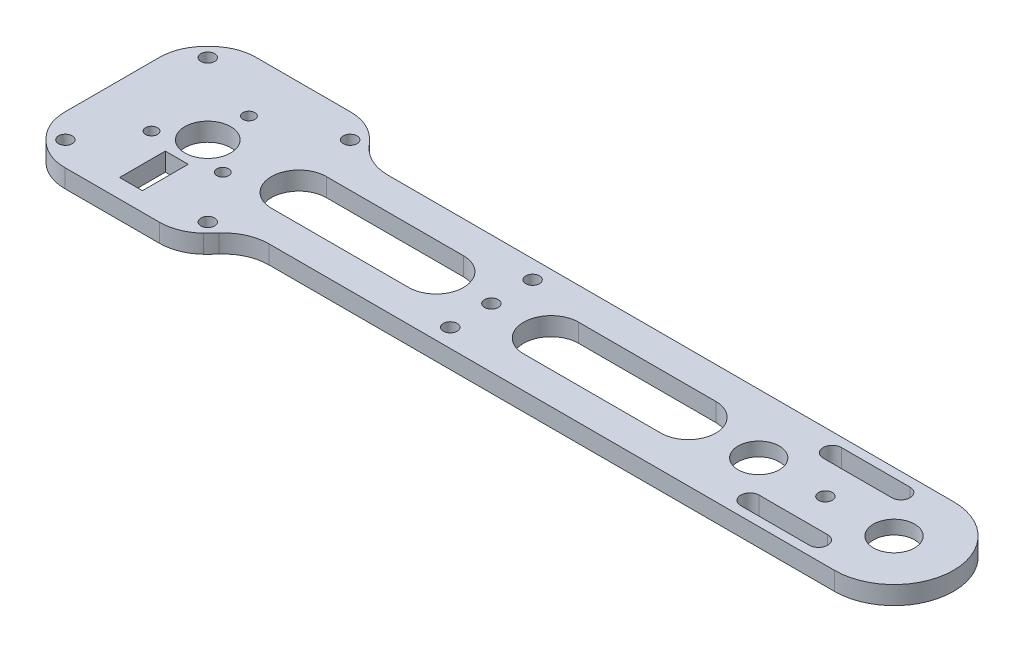
from build123d import *

# Parameters (mm, degrees)
SKETCH_1_R          = 5
SKETCH_1_R_2        = 4.505
SKETCH_1_R_3        = 1.3
SKETCH_1_R_4        = 1.5
SKETCH_1_W          = 5
SKETCH_1_H          = 10
EXTRUDE_1_DEPTH     = 4
SKETCH_2_R          = 6.01
CUT_EXTRUDE_1_DEPTH = 1
CUT_EXTRUDE_4_DEPTH = 4
FILLET_1_R          = 10


with BuildPart() as part:
    # 草图1 → 凸台-拉伸1 (new body)
    with BuildSketch(Plane(origin=(0, 0, 0), x_dir=(1, 0, 0), z_dir=(0, 1, 0))):
        with BuildLine():
            Line((150, 13), (21.354156504, 13))
            ThreePointArc((21.354156504, 13), (17.988228463, 17.361556288), (13.748715927, 20.879961934))
            Line((13.748715927, 20.879961934), (-13.748715927, 20.879961934))
            ThreePointArc((-13.748715927, 20.879961934), (-17.67766953, 17.67766953), (-20.879961934, 13.748715927))
            Line((-20.879961934, 13.748715927), (-20.879961934, -13.748715927))
            ThreePointArc((-20.879961934, -13.748715927), (-17.67766953, -17.67766953), (-13.748715927, -20.879961934))
            Line((-13.748715927, -20.879961934), (13.748715927, -20.879961934))
            ThreePointArc((13.748715927, -20.879961934), (17.988228463, -17.361556288), (21.354156504, -13))
            Line((21.354156504, -13), (150, -13))
            ThreePointArc((150, -13), (163, 0), (150, 13))
        make_face()
        with Locations(Location((0, 0, 0), (0, 0, 270))):
            Circle(SKETCH_1_R, mode=Mode.SUBTRACT)
        with Locations(Location((150, 0, 0), (0, 0, 270))):
            Circle(SKETCH_1_R_2, mode=Mode.SUBTRACT)
        with Locations(Location((120.4195, 0, 0), (0, 0, 270))):
            Circle(SKETCH_1_R_2, mode=Mode.SUBTRACT)
        with Locations(Location((0, 9, 0), (0, 0, 270))):
            Circle(SKETCH_1_R_3, mode=Mode.SUBTRACT)
        with Locations(Location((7.794228634, -4.5, 0), (0, 0, 270))):
            Circle(SKETCH_1_R_3, mode=Mode.SUBTRACT)
        with Locations(Location((-7.794228634, -4.5, 0), (0, 0, 270))):
            Circle(SKETCH_1_R_3, mode=Mode.SUBTRACT)
        with Locations(Location((135, 0, 0), (0, 0, 270))):
            Circle(SKETCH_1_R_4, mode=Mode.SUBTRACT)
        with Locations(Location((62, 0, 0), (0, 0, 270))):
            Circle(SKETCH_1_R_4, mode=Mode.SUBTRACT)
        with Locations(Location((62, 9, 0), (0, 0, 270))):
            Circle(SKETCH_1_R_4, mode=Mode.SUBTRACT)
        with Locations(Location((62, -9, 0), (0, 0, 270))):
            Circle(SKETCH_1_R_4, mode=Mode.SUBTRACT)
        with Locations(Location((-15.556349186, 15.556349186, 0), (0, 0, 270))):
            Circle(SKETCH_1_R_4, mode=Mode.SUBTRACT)
        with Locations(Location((15.556349186, 15.556349186, 0), (0, 0, 270))):
            Circle(SKETCH_1_R_4, mode=Mode.SUBTRACT)
        with Locations(Location((15.556349186, -15.556349186, 0), (0, 0, 270))):
            Circle(SKETCH_1_R_4, mode=Mode.SUBTRACT)
        with Locations(Location((-15.556349186, -15.556349186, 0), (0, 0, 270))):
            Circle(SKETCH_1_R_4, mode=Mode.SUBTRACT)
        with Locations((0, -11.773380776)):
            Rectangle(SKETCH_1_W, SKETCH_1_H, mode=Mode.SUBTRACT)
        with BuildLine():
            Line((49.912097798, -6), (19.912097798, -6))
            ThreePointArc((19.912097798, -6), (13.912097798, 0), (19.912097798, 6))
            Line((19.912097798, 6), (49.912097798, 6))
            ThreePointArc((49.912097798, 6), (55.912097798, 0), (49.912097798, -6))
        make_face(mode=Mode.SUBTRACT)
        with BuildLine():
            Line((105.041482469, -6), (75.041482469, -6))
            ThreePointArc((75.041482469, -6), (69.041482469, 0), (75.041482469, 6))
            Line((75.041482469, 6), (105.041482469, 6))
            ThreePointArc((105.041482469, 6), (111.041482469, 0), (105.041482469, -6))
        make_face(mode=Mode.SUBTRACT)
    extrude(amount=EXTRUDE_1_DEPTH)

    # 草图2 → 切除-拉伸1 (cut)
    with BuildSketch(Plane.XZ):
        with Locations(Location((150, 0, 0), (0, 0, 270))):
            Circle(SKETCH_2_R)
        with Locations(Location((120.4195, 0, 0), (0, 0, 270))):
            Circle(SKETCH_2_R)
    extrude(amount=-CUT_EXTRUDE_1_DEPTH, mode=Mode.SUBTRACT)

    # 草图4 → 切除-拉伸4 (cut)
    with BuildSketch(Plane(origin=(0, 4, 0), x_dir=(1, 0, 0), z_dir=(0, 1, 0))):
        with BuildLine():
            Line((127.5, 11), (142.5, 11))
            ThreePointArc((142.5, 11), (144.5, 9), (142.5, 7))
            Line((142.5, 7), (127.5, 7))
            ThreePointArc((127.5, 7), (125.5, 9), (127.5, 11))
        make_face()
        with BuildLine():
            Line((127.5, -11), (142.5, -11))
            ThreePointArc((142.5, -11), (144.5, -9), (142.5, -7))
            Line((142.5, -7), (127.5, -7))
            ThreePointArc((127.5, -7), (125.5, -9), (127.5, -11))
        make_face()
    extrude(amount=-CUT_EXTRUDE_4_DEPTH, mode=Mode.SUBTRACT)

    # 圆角1
    fillet_1_edges = [part.edges().sort_by_distance(p)[0] for p in [
        (21.354156504, 2, 13),
        (13.748715927, 2, 20.879961934),
        (-13.748715927, 2, 20.879961934),
        (-20.879961934, 2, 13.748715927),
        (-20.879961934, 2, -13.748715927),
        (-13.748715927, 2, -20.879961934),
        (13.748715927, 2, -20.879961934),
        (21.354156504, 2, -13),
    ]]
    fillet(fillet_1_edges, radius=FILLET_1_R)


solid = part.part
